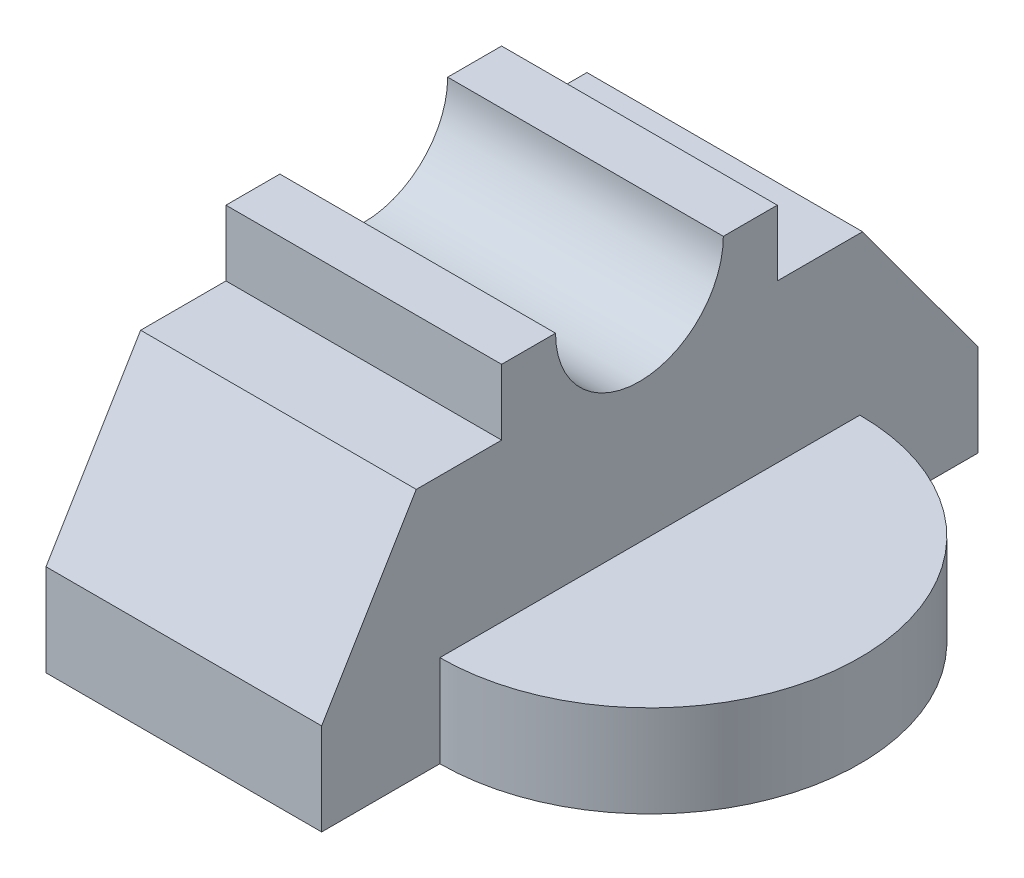
from build123d import *

# Parameters (mm, degrees)
BOSS_EXTRUDE1_DEPTH = 21
BOSS_EXTRUDE2_DEPTH = 14


with BuildPart() as part:
    # Sketch1 → Boss-Extrude1 (new body)
    with BuildSketch(Plane(origin=(0, 0, 0), x_dir=(0, 0, -1), z_dir=(1, 0, 0))):
        with BuildLine():
            Line((-45.865633075, 14), (-45.865633075, 0))
            Line((-45.865633075, 0), (54.134366925, 0))
            Line((54.134366925, 0), (54.134366925, 14))
            Line((54.134366925, 14), (36.550387597, 38))
            Line((36.550387597, 38), (23.550387597, 38))
            Line((23.550387597, 38), (23.550387597, 48))
            Line((23.550387597, 48), (15.333333333, 48))
            ThreePointArc((15.333333333, 48), (2.550387597, 35.217054264), (-10.23255814, 48))
            Line((-10.23255814, 48), (-18.449612403, 48))
            Line((-18.449612403, 48), (-18.449612403, 38))
            Line((-18.449612403, 38), (-31.449612403, 38))
            Line((-31.449612403, 38), (-45.865633075, 14))
        make_face()
    extrude(amount=-BOSS_EXTRUDE1_DEPTH)

    # Mirror1: part across plane


with BuildPart() as part_1:
    add(part.part)
    add(part.part.mirror(Plane.ZY.offset(21)))

    # Sketch3 → Boss-Extrude2 (add)
    with BuildSketch(Plane.XZ):
        with BuildLine():
            Line((0, 27.865633075), (0, 24.200007191))
            Line((0, 24.200007191), (0, -20.725134363))
            Line((0, -20.725134363), (0, -36.134366925))
            ThreePointArc((0, -36.134366925), (22.627416998, -26.761783923), (32, -4.134366925))
            ThreePointArc((32, -4.134366925), (22.627416998, 18.493050073), (0, 27.865633075))
        make_face()
        with BuildLine():
            Line((0, -20.725134363), (0, 24.200007191))
            Line((0, 24.200007191), (0, 27.865633075))
            ThreePointArc((0, 27.865633075), (-32, -4.134366925), (0, -36.134366925))
            Line((0, -36.134366925), (0, -20.725134363))
        make_face()
    extrude(amount=-BOSS_EXTRUDE2_DEPTH)


solid = part_1.part
